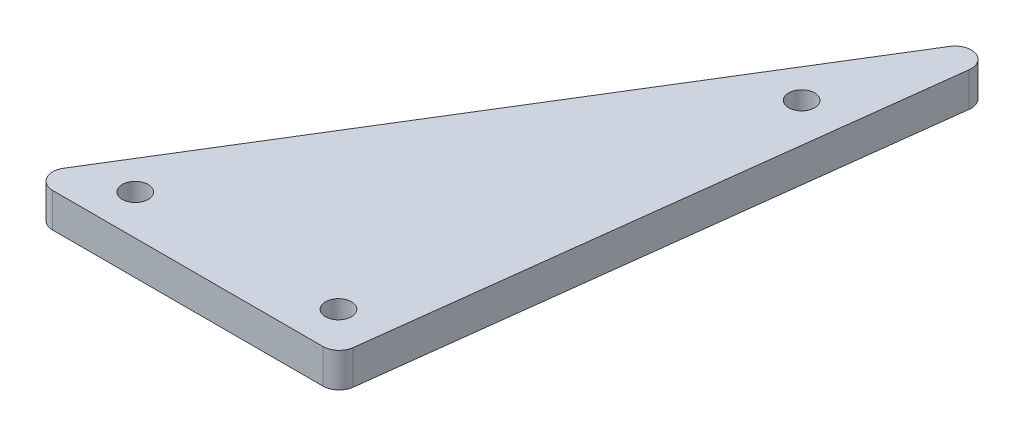
from build123d import *

# Parameters (mm, degrees)
BOSS_EXTRUDE1_DEPTH = 6.35
SKETCH2_R           = 2.4
CUT_EXTRUDE1_DEPTH  = 129.853705369


with BuildPart() as part:
    # Sketch1 → Boss-Extrude1 (new body)
    with BuildSketch(Plane(origin=(0, 0, 0), x_dir=(1, 0, 0), z_dir=(0, 1, 0))):
        with BuildLine():
            Line((5.368406408, 0), (55.345824206, 0))
            ThreePointArc((55.345824206, 0), (57.333684351, 0.753132838), (58.323462661, 2.63439197))
            Line((58.323462661, 2.63439197), (70.782326451, 104.103694773))
            ThreePointArc((70.782326451, 104.103694773), (68.796352117, 107.300663302), (65.249641496, 106.041478805))
            Line((65.249641496, 106.041478805), (2.813359907, 4.572176002))
            ThreePointArc((2.813359907, 4.572176002), (2.749577661, 1.536532885), (5.368406408, 0))
        make_face()
    extrude(amount=BOSS_EXTRUDE1_DEPTH)

    # Sketch2 → Cut-Extrude1 (cut, through all)
    with BuildSketch(Plane(origin=(0, 6.35, 0), x_dir=(1, 0, 0), z_dir=(0, 1, 0))):
        with Locations(Location((13.240494573, 7.4, 0), (0, 0, 270))):
            Circle(SKETCH2_R)
        with Locations(Location((60.1907906, 83.69973137, 0), (0, 0, 270))):
            Circle(SKETCH2_R)
        with Locations(Location((50.822361587, 7.4, 0), (0, 0, 270))):
            Circle(SKETCH2_R)
    extrude(amount=-CUT_EXTRUDE1_DEPTH, mode=Mode.SUBTRACT)


solid = part.part
